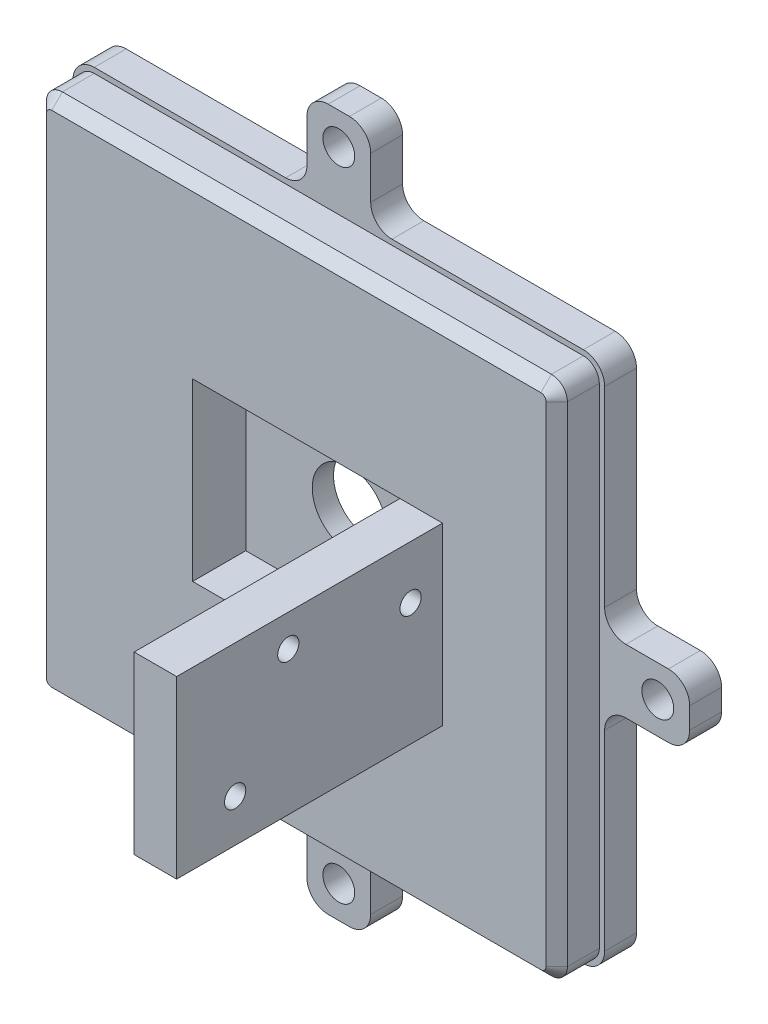
from build123d import *

# Parameters (mm, degrees)
SKETCH1_W           = 50
SKETCH1_H           = 50
BOSS_EXTRUDE1_DEPTH = 7
SKETCH3_W           = 19.5
SKETCH3_H           = 16.5
CUT_EXTRUDE1_DEPTH  = 5
SKETCH4_R           = 3.5
CUT_EXTRUDE2_DEPTH  = 5
CUT_EXTRUDE4_DEPTH  = 37.041642582
SKETCH6_W           = 4
SKETCH6_H           = 16.5
BOSS_EXTRUDE2_DEPTH = 25
SKETCH7_R           = 1
CUT_EXTRUDE5_DEPTH  = 57.129871726
SKETCH10_W          = 6
SKETCH10_H          = 8
SKETCH10_R          = 1.5
SKETCH10_W_2        = 8
SKETCH10_H_2        = 6
BOSS_EXTRUDE3_DEPTH = 3
FILLET1_R           = 2
FILLET2_R           = 2
CUT_EXTRUDE6_DEPTH  = 4
CHAMFER1_SIZE       = 1


with BuildPart() as part:
    # Sketch1 → Boss-Extrude1 (new body)
    with BuildSketch(Plane.XY):
        Rectangle(SKETCH1_W, SKETCH1_H)
    extrude(amount=BOSS_EXTRUDE1_DEPTH)

    # Sketch3 → Cut-Extrude1 (cut)
    with BuildSketch(Plane.XY.offset(7)):
        Rectangle(SKETCH3_W, SKETCH3_H)
    extrude(amount=-CUT_EXTRUDE1_DEPTH, mode=Mode.SUBTRACT)

    # Sketch4 → Cut-Extrude2 (cut)
    with BuildSketch(Plane.XY.offset(2)):
        Circle(SKETCH4_R)
    extrude(amount=-CUT_EXTRUDE2_DEPTH, mode=Mode.SUBTRACT)

    # Sketch5 → Cut-Extrude4 (cut, through all)
    with BuildSketch(Plane.XY.offset(7)):
        with BuildLine():
            Line((-4, -8.25), (4, -8.25))
            ThreePointArc((4, -8.25), (0, -12.25), (-4, -8.25))
        make_face()
    extrude(amount=-CUT_EXTRUDE4_DEPTH, mode=Mode.SUBTRACT)

    # Sketch6 → Boss-Extrude2 (add)
    with BuildSketch(Plane.XY.offset(7)):
        with Locations((11.75, 0)):
            Rectangle(SKETCH6_W, SKETCH6_H)
    extrude(amount=BOSS_EXTRUDE2_DEPTH)

    # Sketch7 → Cut-Extrude5 (cut, through all)
    with BuildSketch(Plane(origin=(13.75, 0, 0), x_dir=(0, 0, -1), z_dir=(1, 0, 0))):
        with Locations((-10, 3.25)):
            Circle(SKETCH7_R)
        with Locations((-26.5, -4.25)):
            Circle(SKETCH7_R)
        with Locations((-21.5, 5.25)):
            Circle(SKETCH7_R)
    extrude(amount=-CUT_EXTRUDE5_DEPTH, mode=Mode.SUBTRACT)

    # Sketch10 → Boss-Extrude3 (add)
    # profile 1 of 3: a face of its own
    with BuildSketch(Plane(origin=(0, 0, 0), x_dir=(-1, 0, 0), z_dir=(0, 0, -1))):
        with Locations((0, 29)):
            Rectangle(SKETCH10_W, SKETCH10_H)
        with Locations((0, 30)):
            Circle(SKETCH10_R, mode=Mode.SUBTRACT)
    # profile 2 of 3: a face of its own
    with BuildSketch(Plane(origin=(0, 0, 0), x_dir=(-1, 0, 0), z_dir=(0, 0, -1))):
        with Locations((-29, 0)):
            Rectangle(SKETCH10_W_2, SKETCH10_H_2)
        with Locations((-30, 0)):
            Circle(SKETCH10_R, mode=Mode.SUBTRACT)
    # profile 3 of 3: a face of its own
    with BuildSketch(Plane(origin=(0, 0, 0), x_dir=(-1, 0, 0), z_dir=(0, 0, -1))):
        with Locations((0, -29)):
            Rectangle(SKETCH10_W, SKETCH10_H)
        with Locations((0, -30)):
            Circle(SKETCH10_R, mode=Mode.SUBTRACT)
    extrude(amount=-BOSS_EXTRUDE3_DEPTH)

    # Fillet1
    fillet1_edges = [part.edges().sort_by_distance(p)[0] for p in [
        (3, -25, 1.5),
        (-3, -25, 1.5),
        (-3, -33, 1.5),
        (3, -33, 1.5),
        (25, 3, 1.5),
        (25, -3, 1.5),
        (33, -3, 1.5),
        (33, 3, 1.5),
        (-3, 25, 1.5),
        (3, 25, 1.5),
        (3, 33, 1.5),
        (-3, 33, 1.5),
    ]]
    fillet(fillet1_edges, radius=FILLET1_R)

    # Fillet2
    fillet2_edges = [part.edges().sort_by_distance(p)[0] for p in [
        (25, -25, 3.5),
        (-25, -25, 3.5),
        (-25, 25, 3.5),
        (25, 25, 3.5),
    ]]
    fillet(fillet2_edges, radius=FILLET2_R)

    # Sketch11 → Cut-Extrude6 (cut)
    with BuildSketch(Plane.XY.offset(7)):
        with BuildLine():
            Line((23, 25), (-23, 25))
            ThreePointArc((-23, 25), (-24.414213562, 24.414213562), (-25, 23))
            Line((-25, 23), (-25, -23))
            ThreePointArc((-25, -23), (-24.414213562, -24.414213562), (-23, -25))
            Line((-23, -25), (23, -25))
            ThreePointArc((23, -25), (24.414213562, -24.414213562), (25, -23))
            Line((25, -23), (25, 23))
            ThreePointArc((25, 23), (24.414213562, 24.414213562), (23, 25))
        make_face()
        with BuildLine():
            Line((23, 24.5), (-23, 24.5))
            ThreePointArc((-23, 24.5), (-24.060660172, 24.060660172), (-24.5, 23))
            Line((-24.5, 23), (-24.5, -23))
            ThreePointArc((-24.5, -23), (-24.060660172, -24.060660172), (-23, -24.5))
            Line((-23, -24.5), (23, -24.5))
            ThreePointArc((23, -24.5), (24.060660172, -24.060660172), (24.5, -23))
            Line((24.5, -23), (24.5, 23))
            ThreePointArc((24.5, 23), (24.060660172, 24.060660172), (23, 24.5))
        make_face(mode=Mode.SUBTRACT)
    extrude(amount=-CUT_EXTRUDE6_DEPTH, mode=Mode.SUBTRACT)

    # Chamfer1
    chamfer1_edges = [part.edges().sort_by_distance(p)[0] for p in [
        (0, 24.5, 7),
        (-24.060660172, 24.060660172, 7),
        (-24.5, 0, 7),
        (-24.060660172, -24.060660172, 7),
        (0, -24.5, 7),
        (24.060660172, -24.060660172, 7),
        (24.5, 0, 7),
        (24.060660172, 24.060660172, 7),
    ]]
    chamfer(chamfer1_edges, length=CHAMFER1_SIZE)


solid = part.part
